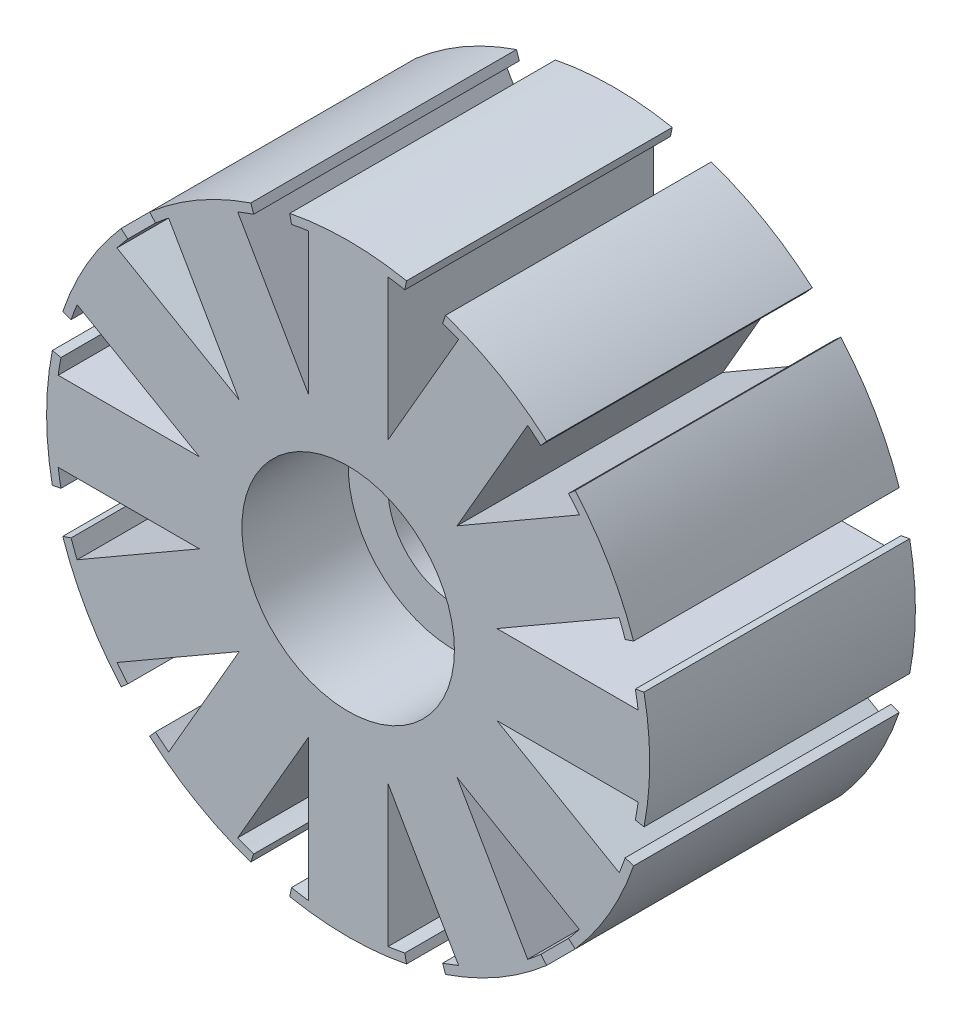
from build123d import *

# Parameters (mm, degrees)
BOSS_EXTRUDE1_DEPTH = 10
SKETCH3_R           = 4
CUT_EXTRUDE1_DEPTH  = 4
SKETCH4_R           = 2.5
CUT_EXTRUDE2_DEPTH  = 10


with BuildPart() as part:
    # Sketch2 → Boss-Extrude1 (new body)
    with BuildSketch(Plane.XY):
        with BuildLine():
            Line((2.133108761, 10.808181691), (2.19765063, 11.135206855))
            ThreePointArc((2.19765063, 11.135206855), (0, 11.35), (-2.19765063, 11.135206855))
            Line((-2.19765063, 11.135206855), (-2.133108761, 10.808181691))
            ThreePointArc((-2.133108761, 10.808181691), (-1.817325769, 10.865738424), (-1.5, 10.914070939))
            Line((-1.5, 10.914070939), (-1.5, 5.598076211))
            Line((-1.5, 5.598076211), (-4.157997364, 10.201862691))
            ThreePointArc((-4.157997364, 10.201862691), (-3.859018929, 10.318668391), (-3.556764469, 10.426714294))
            Line((-3.556764469, 10.426714294), (-3.664382154, 10.742197328))
            ThreePointArc((-3.664382154, 10.742197328), (-5.675, 9.829388333), (-7.470824702, 8.544546698))
            Line((-7.470824702, 8.544546698), (-7.251417222, 8.293605533))
            ThreePointArc((-7.251417222, 8.293605533), (-7.006719495, 8.501342622), (-6.756073575, 8.701862691))
            Line((-6.756073575, 8.701862691), (-4.098076211, 4.098076211))
            Line((-4.098076211, 4.098076211), (-8.701862691, 6.756073575))
            ThreePointArc((-8.701862691, 6.756073575), (-8.501342622, 7.006719495), (-8.293605533, 7.251417222))
            Line((-8.293605533, 7.251417222), (-8.544546698, 7.470824702))
            ThreePointArc((-8.544546698, 7.470824702), (-9.829388333, 5.675), (-10.742197328, 3.664382154))
            Line((-10.742197328, 3.664382154), (-10.426714294, 3.556764469))
            ThreePointArc((-10.426714294, 3.556764469), (-10.318668391, 3.859018929), (-10.201862691, 4.157997364))
            Line((-10.201862691, 4.157997364), (-5.598076211, 1.5))
            Line((-5.598076211, 1.5), (-10.914070939, 1.5))
            ThreePointArc((-10.914070939, 1.5), (-10.865738424, 1.817325769), (-10.808181691, 2.133108761))
            Line((-10.808181691, 2.133108761), (-11.135206855, 2.19765063))
            ThreePointArc((-11.135206855, 2.19765063), (-11.35, 0), (-11.135206855, -2.19765063))
            Line((-11.135206855, -2.19765063), (-10.808181691, -2.133108761))
            ThreePointArc((-10.808181691, -2.133108761), (-10.865738424, -1.817325769), (-10.914070939, -1.5))
            Line((-10.914070939, -1.5), (-5.598076211, -1.5))
            Line((-5.598076211, -1.5), (-10.201862691, -4.157997364))
            ThreePointArc((-10.201862691, -4.157997364), (-10.318668391, -3.859018929), (-10.426714294, -3.556764469))
            Line((-10.426714294, -3.556764469), (-10.742197328, -3.664382154))
            ThreePointArc((-10.742197328, -3.664382154), (-9.829388333, -5.675), (-8.544546698, -7.470824702))
            Line((-8.544546698, -7.470824702), (-8.293605533, -7.251417222))
            ThreePointArc((-8.293605533, -7.251417222), (-8.501342622, -7.006719495), (-8.701862691, -6.756073575))
            Line((-8.701862691, -6.756073575), (-4.098076211, -4.098076211))
            Line((-4.098076211, -4.098076211), (-6.756073575, -8.701862691))
            ThreePointArc((-6.756073575, -8.701862691), (-7.006719495, -8.501342622), (-7.251417222, -8.293605533))
            Line((-7.251417222, -8.293605533), (-7.470824702, -8.544546698))
            ThreePointArc((-7.470824702, -8.544546698), (-5.675, -9.829388333), (-3.664382154, -10.742197328))
            Line((-3.664382154, -10.742197328), (-3.556764469, -10.426714294))
            ThreePointArc((-3.556764469, -10.426714294), (-3.859018929, -10.318668391), (-4.157997364, -10.201862691))
            Line((-4.157997364, -10.201862691), (-1.5, -5.598076211))
            Line((-1.5, -5.598076211), (-1.5, -10.914070939))
            ThreePointArc((-1.5, -10.914070939), (-1.817325769, -10.865738424), (-2.133108761, -10.808181691))
            Line((-2.133108761, -10.808181691), (-2.19765063, -11.135206855))
            ThreePointArc((-2.19765063, -11.135206855), (0, -11.35), (2.19765063, -11.135206855))
            Line((2.19765063, -11.135206855), (2.133108761, -10.808181691))
            ThreePointArc((2.133108761, -10.808181691), (1.817325769, -10.865738424), (1.5, -10.914070939))
            Line((1.5, -10.914070939), (1.5, -5.598076211))
            Line((1.5, -5.598076211), (4.157997364, -10.201862691))
            ThreePointArc((4.157997364, -10.201862691), (3.859018929, -10.318668391), (3.556764469, -10.426714294))
            Line((3.556764469, -10.426714294), (3.664382154, -10.742197328))
            ThreePointArc((3.664382154, -10.742197328), (5.675, -9.829388333), (7.470824702, -8.544546698))
            Line((7.470824702, -8.544546698), (7.251417222, -8.293605533))
            ThreePointArc((7.251417222, -8.293605533), (7.006719495, -8.501342622), (6.756073575, -8.701862691))
            Line((6.756073575, -8.701862691), (4.098076211, -4.098076211))
            Line((4.098076211, -4.098076211), (8.701862691, -6.756073575))
            ThreePointArc((8.701862691, -6.756073575), (8.501342622, -7.006719495), (8.293605533, -7.251417222))
            Line((8.293605533, -7.251417222), (8.544546698, -7.470824702))
            ThreePointArc((8.544546698, -7.470824702), (9.829388333, -5.675), (10.742197328, -3.664382154))
            Line((10.742197328, -3.664382154), (10.426714294, -3.556764469))
            ThreePointArc((10.426714294, -3.556764469), (10.318668391, -3.859018929), (10.201862691, -4.157997364))
            Line((10.201862691, -4.157997364), (5.598076211, -1.5))
            Line((5.598076211, -1.5), (10.914070939, -1.5))
            ThreePointArc((10.914070939, -1.5), (10.865738424, -1.817325769), (10.808181691, -2.133108761))
            Line((10.808181691, -2.133108761), (11.135206855, -2.19765063))
            ThreePointArc((11.135206855, -2.19765063), (11.35, 0), (11.135206855, 2.19765063))
            Line((11.135206855, 2.19765063), (10.808181691, 2.133108761))
            ThreePointArc((10.808181691, 2.133108761), (10.865738424, 1.817325769), (10.914070939, 1.5))
            Line((10.914070939, 1.5), (5.598076211, 1.5))
            Line((5.598076211, 1.5), (10.201862691, 4.157997364))
            ThreePointArc((10.201862691, 4.157997364), (10.318668391, 3.859018929), (10.426714294, 3.556764469))
            Line((10.426714294, 3.556764469), (10.742197328, 3.664382154))
            ThreePointArc((10.742197328, 3.664382154), (9.829388333, 5.675), (8.544546698, 7.470824702))
            Line((8.544546698, 7.470824702), (8.293605533, 7.251417222))
            ThreePointArc((8.293605533, 7.251417222), (8.501342622, 7.006719495), (8.701862691, 6.756073575))
            Line((8.701862691, 6.756073575), (4.098076211, 4.098076211))
            Line((4.098076211, 4.098076211), (6.756073575, 8.701862691))
            ThreePointArc((6.756073575, 8.701862691), (7.006719495, 8.501342622), (7.251417222, 8.293605533))
            Line((7.251417222, 8.293605533), (7.470824702, 8.544546698))
            ThreePointArc((7.470824702, 8.544546698), (5.675, 9.829388333), (3.664382154, 10.742197328))
            Line((3.664382154, 10.742197328), (3.556764469, 10.426714294))
            ThreePointArc((3.556764469, 10.426714294), (3.859018929, 10.318668391), (4.157997364, 10.201862691))
            Line((4.157997364, 10.201862691), (1.5, 5.598076211))
            Line((1.5, 5.598076211), (1.5, 10.914070939))
            ThreePointArc((1.5, 10.914070939), (1.817325769, 10.865738424), (2.133108761, 10.808181691))
        make_face()
    extrude(amount=BOSS_EXTRUDE1_DEPTH)

    # Sketch3 → Cut-Extrude1 (cut)
    with BuildSketch(Plane.XY.offset(10)):
        Circle(SKETCH3_R)
    extrude(amount=-CUT_EXTRUDE1_DEPTH, mode=Mode.SUBTRACT)

    # Sketch4 → Cut-Extrude2 (cut)
    with BuildSketch(Plane.XY.offset(6)):
        Circle(SKETCH4_R)
    extrude(amount=-CUT_EXTRUDE2_DEPTH, mode=Mode.SUBTRACT)


solid = part.part
